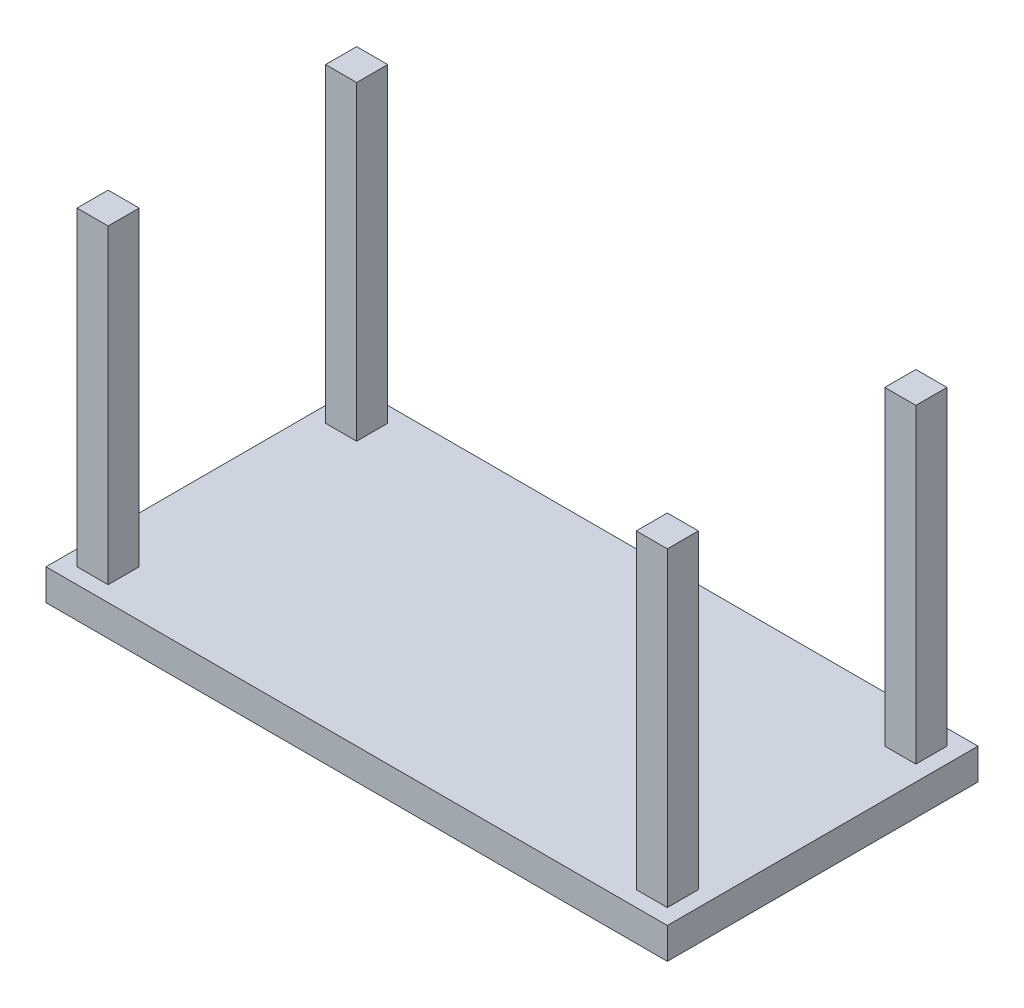
from build123d import *

# Parameters (mm, degrees)
SKETCH1_W           = 200
SKETCH1_H           = 100
BOSS_EXTRUDE1_DEPTH = 10
SKETCH2_W           = 10
SKETCH2_H           = 10
BOSS_EXTRUDE2_DEPTH = 100


with BuildPart() as part:
    # Sketch1 → Boss-Extrude1 (new body)
    with BuildSketch(Plane(origin=(0, 0, 0), x_dir=(1, 0, 0), z_dir=(0, 1, 0))):
        Rectangle(SKETCH1_W, SKETCH1_H)
    extrude(amount=BOSS_EXTRUDE1_DEPTH)

    # Sketch2 → Boss-Extrude2 (add)
    with BuildSketch(Plane(origin=(0, 10, 0), x_dir=(1, 0, 0), z_dir=(0, 1, 0))):
        with Locations((-90, 40)):
            Rectangle(SKETCH2_W, SKETCH2_H)
        with Locations((90, 40)):
            Rectangle(SKETCH2_W, SKETCH2_H)
        with Locations((90, -40)):
            Rectangle(SKETCH2_W, SKETCH2_H)
        with Locations((-90, -40)):
            Rectangle(SKETCH2_W, SKETCH2_H)
    extrude(amount=BOSS_EXTRUDE2_DEPTH)


solid = part.part
